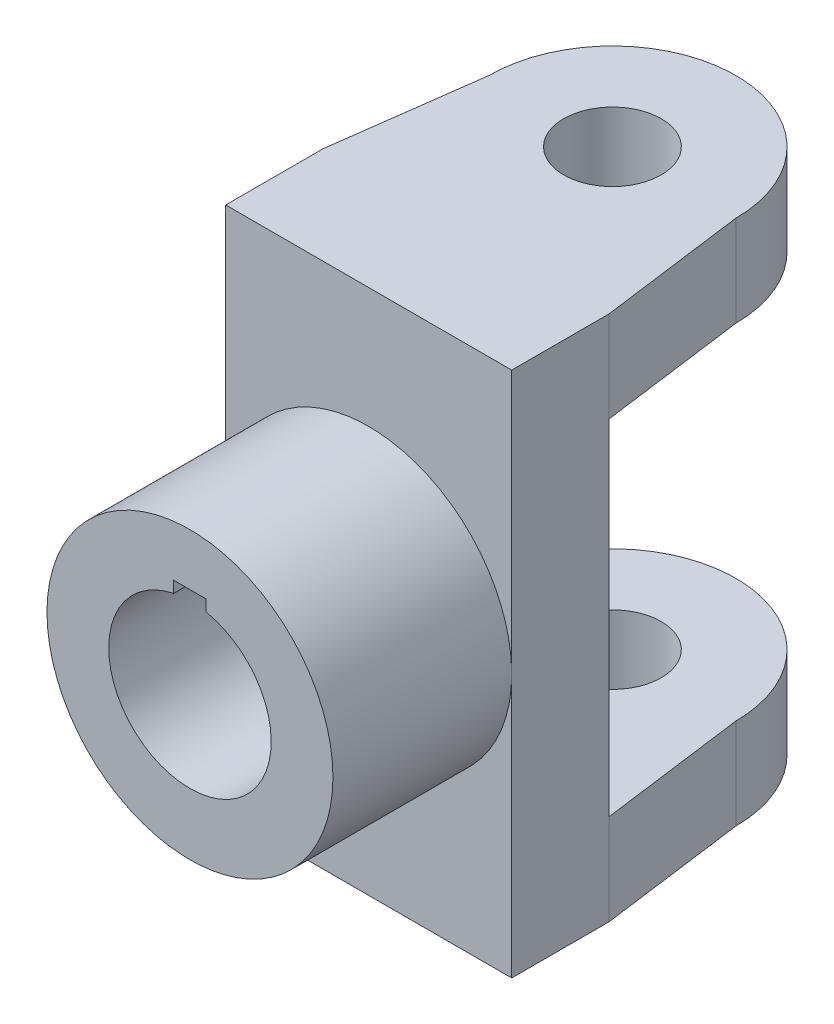
from build123d import *

# Parameters (mm, degrees)
SKETCH1_W           = 88
SKETCH1_H           = 162
BOSS_EXTRUDE1_DEPTH = 30
SKETCH2_R           = 44
BOSS_EXTRUDE2_DEPTH = 55
SKETCH3_R           = 15
BOSS_EXTRUDE3_DEPTH = 28


with BuildPart() as part:
    # Sketch1 → Boss-Extrude1 (new body)
    with BuildSketch(Plane.XY):
        Rectangle(SKETCH1_W, SKETCH1_H)
    extrude(amount=BOSS_EXTRUDE1_DEPTH)

    # Sketch2 → Boss-Extrude2 (add)
    with BuildSketch(Plane.XY.offset(30)):
        Circle(SKETCH2_R)
        with BuildLine():
            Line((-5, 24.494897428), (-5, 28))
            Line((-5, 28), (5, 28))
            Line((5, 28), (5, 24.494897428))
            ThreePointArc((5, 24.494897428), (0, -25), (-5, 24.494897428))
        make_face(mode=Mode.SUBTRACT)
    extrude(amount=BOSS_EXTRUDE2_DEPTH)

    # Sketch3 → Boss-Extrude3 (add)
    with BuildSketch(Plane.XZ.offset(81)):
        with BuildLine():
            Line((-44, 0), (-38, -45))
            ThreePointArc((-38, -45), (0, -83), (38, -45))
            Line((38, -45), (44, 0))
            Line((44, 0), (-44, 0))
        make_face()
        with Locations(Location((0, -45, 0), (0, 0, 270))):
            Circle(SKETCH3_R, mode=Mode.SUBTRACT)
    boss_extrude3 = extrude(amount=-BOSS_EXTRUDE3_DEPTH)

    # Mirror1: Boss-Extrude3 across plane
    add(boss_extrude3.mirror(Plane.ZX))


solid = part.part
